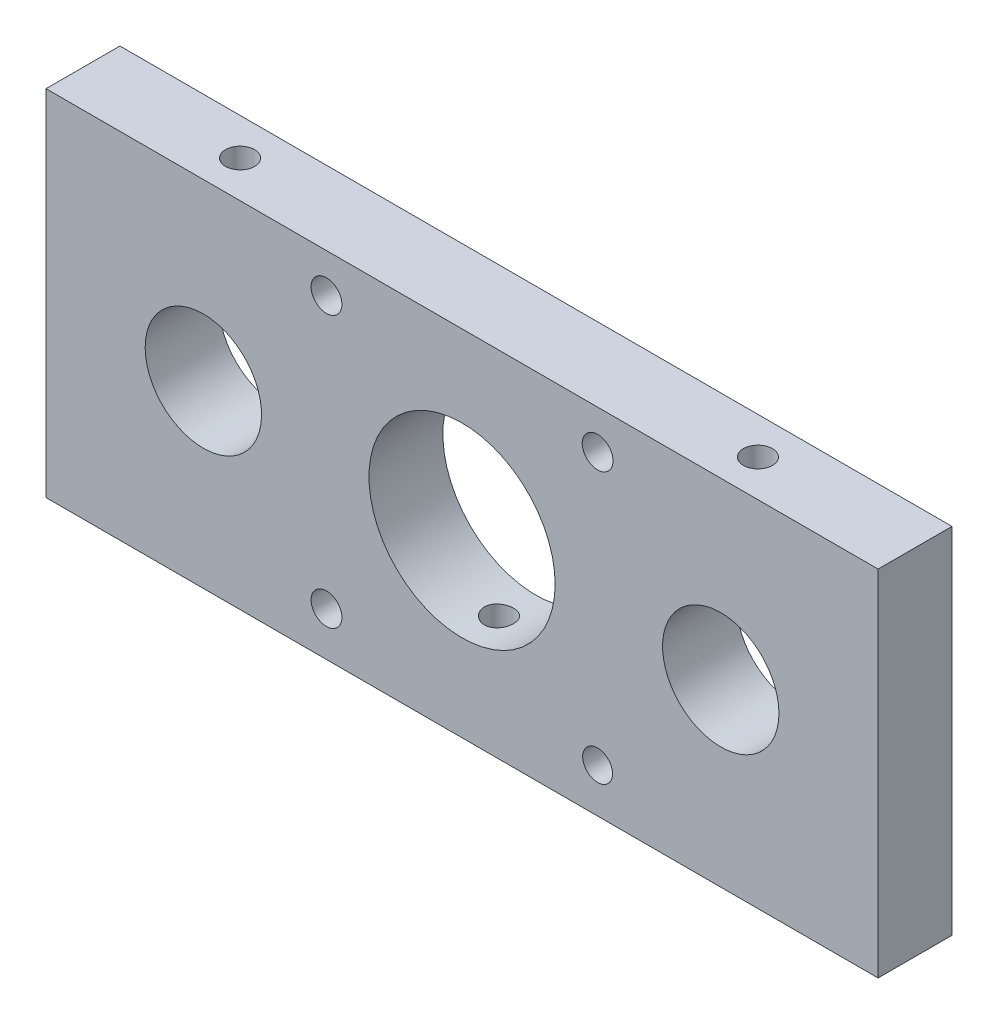
from build123d import *

# Parameters (mm, degrees)
ESBO_O1_W                = 143.01
ESBO_O1_H                = 54
RESSALTO_EXTRUS_O1_DEPTH = 10
ESBO_O14_W               = 2.7
ESBO_O14_H               = 57.87
RESSALTO_EXTRUS_O3_DEPTH = 143.01
ESBO_O2_R                = 16
CIRCULO_ROLAMENTO_DEPTH  = 19
ESBO_O7_R                = 10
CORTE_EXTRUS_O3_DEPTH    = 19
ESBO_O8_W                = 143.01
ESBO_O8_H                = 3.87
RESSALTO_EXTRUS_O2_DEPTH = 10
ESBO_O22_W               = 143.01
ESBO_O22_H               = 3
RESSALTO_EXTRUS_O4_DEPTH = 12.7
ESBO_O12_R               = 2.5
CORTE_EXTRUS_O6_DEPTH    = 17
CORTE_EXTRUS_O15_REACH   = 80.913
ESBO_O9_R                = 2.568489929
ESBO_O9_R_2              = 2.65
CORTE_EXTRUS_O16_REACH   = 96.436
ESBO_O23_R               = 2.5


with BuildPart() as part:
    # Esboço1 → Ressalto-extrusão1 (new body)
    with BuildSketch(Plane.XY):
        Rectangle(ESBO_O1_W, ESBO_O1_H)
    extrude(amount=RESSALTO_EXTRUS_O1_DEPTH)

    # Esboço14 → Ressalto-extrusão3 (add)
    with BuildSketch(Plane.ZY.offset(71.505)):
        with Locations((-1.35, -1.935)):
            Rectangle(ESBO_O14_W, ESBO_O14_H)
    extrude(amount=-RESSALTO_EXTRUS_O3_DEPTH)

    # Esboço2 → Circulo rolamento (cut)
    with BuildSketch(Plane.XY.offset(10)):
        Circle(ESBO_O2_R)
    extrude(amount=-CIRCULO_ROLAMENTO_DEPTH, mode=Mode.SUBTRACT)

    # Esboço7 → Corte-extrusão3 (cut)
    with BuildSketch(Plane.XY.offset(10)):
        with Locations(Location((-44.465, 0, 0), (0, 0, 90))):
            Circle(ESBO_O7_R)
        with Locations((44.465, 0)):
            Circle(ESBO_O7_R)
    extrude(amount=-CORTE_EXTRUS_O3_DEPTH, mode=Mode.SUBTRACT)

    # Esboço8 → Ressalto-extrusão2 (add)
    with BuildSketch(Plane.XY.offset(10)):
        with Locations((0, -28.935)):
            Rectangle(ESBO_O8_W, ESBO_O8_H)
    extrude(amount=-RESSALTO_EXTRUS_O2_DEPTH)

    # Esboço22 → Ressalto-extrusão4 (add)
    with BuildSketch(Plane.XY.offset(10)):
        with Locations((0, 28.5)):
            Rectangle(ESBO_O22_W, ESBO_O22_H)
    extrude(amount=-RESSALTO_EXTRUS_O4_DEPTH)

    # Esboço12 → Corte-extrusão6 (cut)
    with BuildSketch(Plane.XZ.offset(30.87)):
        with Locations(Location((-61.505, 3.65, 0), (0, 0, 270))):
            Circle(ESBO_O12_R)
        with Locations(Location((33.505, 3.65, 0), (0, 0, 90))):
            Circle(ESBO_O12_R)
        with Locations(Location((0, 3.65, 0), (0, 0, 270))):
            Circle(ESBO_O12_R)
        with Locations(Location((-33.505, 3.65, 0), (0, 0, 270))):
            Circle(ESBO_O12_R)
        with Locations(Location((61.505, 3.65, 0), (0, 0, 90))):
            Circle(ESBO_O12_R)
    extrude(amount=-CORTE_EXTRUS_O6_DEPTH, mode=Mode.SUBTRACT)

    # Esboço9 → Corte-extrusão15 (cut, up to next)
    with BuildSketch(Plane.XY.offset(10), mode=Mode.PRIVATE) as corte_extrus_o15_sk1:
        with Locations((23.3, -23.3)):
            Circle(ESBO_O9_R)
    corte_extrus_o15_tool1 = extrude(corte_extrus_o15_sk1.sketch, amount=-CORTE_EXTRUS_O15_REACH, mode=Mode.PRIVATE) & part.part
    # Esboço9 → Corte-extrusão15 (cut, up to next)
    with BuildSketch(Plane.XY.offset(10), mode=Mode.PRIVATE) as corte_extrus_o15_sk2:
        with Locations((23.3, 23.3)):
            Circle(ESBO_O9_R_2)
    corte_extrus_o15_tool2 = extrude(corte_extrus_o15_sk2.sketch, amount=-CORTE_EXTRUS_O15_REACH, mode=Mode.PRIVATE) & part.part
    # Esboço9 → Corte-extrusão15 (cut, up to next)
    with BuildSketch(Plane.XY.offset(10), mode=Mode.PRIVATE) as corte_extrus_o15_sk3:
        with Locations((-23.3, -23.3)):
            Circle(ESBO_O9_R_2)
    corte_extrus_o15_tool3 = extrude(corte_extrus_o15_sk3.sketch, amount=-CORTE_EXTRUS_O15_REACH, mode=Mode.PRIVATE) & part.part
    # Esboço9 → Corte-extrusão15 (cut, up to next)
    with BuildSketch(Plane.XY.offset(10), mode=Mode.PRIVATE) as corte_extrus_o15_sk4:
        with Locations((-23.3, 23.3)):
            Circle(ESBO_O9_R_2)
    corte_extrus_o15_tool4 = extrude(corte_extrus_o15_sk4.sketch, amount=-CORTE_EXTRUS_O15_REACH, mode=Mode.PRIVATE) & part.part
    add(corte_extrus_o15_tool1.solids().sort_by_distance((23.3, -23.3, 10))[0], mode=Mode.SUBTRACT)
    add(corte_extrus_o15_tool2.solids().sort_by_distance((23.3, 23.3, 10))[0], mode=Mode.SUBTRACT)
    add(corte_extrus_o15_tool3.solids().sort_by_distance((-23.3, -23.3, 10))[0], mode=Mode.SUBTRACT)
    add(corte_extrus_o15_tool4.solids().sort_by_distance((-23.3, 23.3, 10))[0], mode=Mode.SUBTRACT)

    # Esboço23 → Corte-extrusão16 (cut, up to next)
    with BuildSketch(Plane(origin=(0, 30, 0), x_dir=(1, 0, 0), z_dir=(0, 1, 0)), mode=Mode.PRIVATE) as corte_extrus_o16_sk1:
        with Locations(Location((-44.505, -3.65, 0), (0, 0, 270))):
            Circle(ESBO_O23_R)
    corte_extrus_o16_tool1 = extrude(corte_extrus_o16_sk1.sketch, amount=-CORTE_EXTRUS_O16_REACH, mode=Mode.PRIVATE) & part.part
    # Esboço23 → Corte-extrusão16 (cut, up to next)
    with BuildSketch(Plane(origin=(0, 30, 0), x_dir=(1, 0, 0), z_dir=(0, 1, 0)), mode=Mode.PRIVATE) as corte_extrus_o16_sk2:
        with Locations(Location((44.505, -3.65, 0), (0, 0, 270))):
            Circle(ESBO_O23_R)
    corte_extrus_o16_tool2 = extrude(corte_extrus_o16_sk2.sketch, amount=-CORTE_EXTRUS_O16_REACH, mode=Mode.PRIVATE) & part.part
    add(corte_extrus_o16_tool1.solids().sort_by_distance((-44.505, 30, 3.65))[0], mode=Mode.SUBTRACT)
    add(corte_extrus_o16_tool2.solids().sort_by_distance((44.505, 30, 3.65))[0], mode=Mode.SUBTRACT)


solid = part.part
